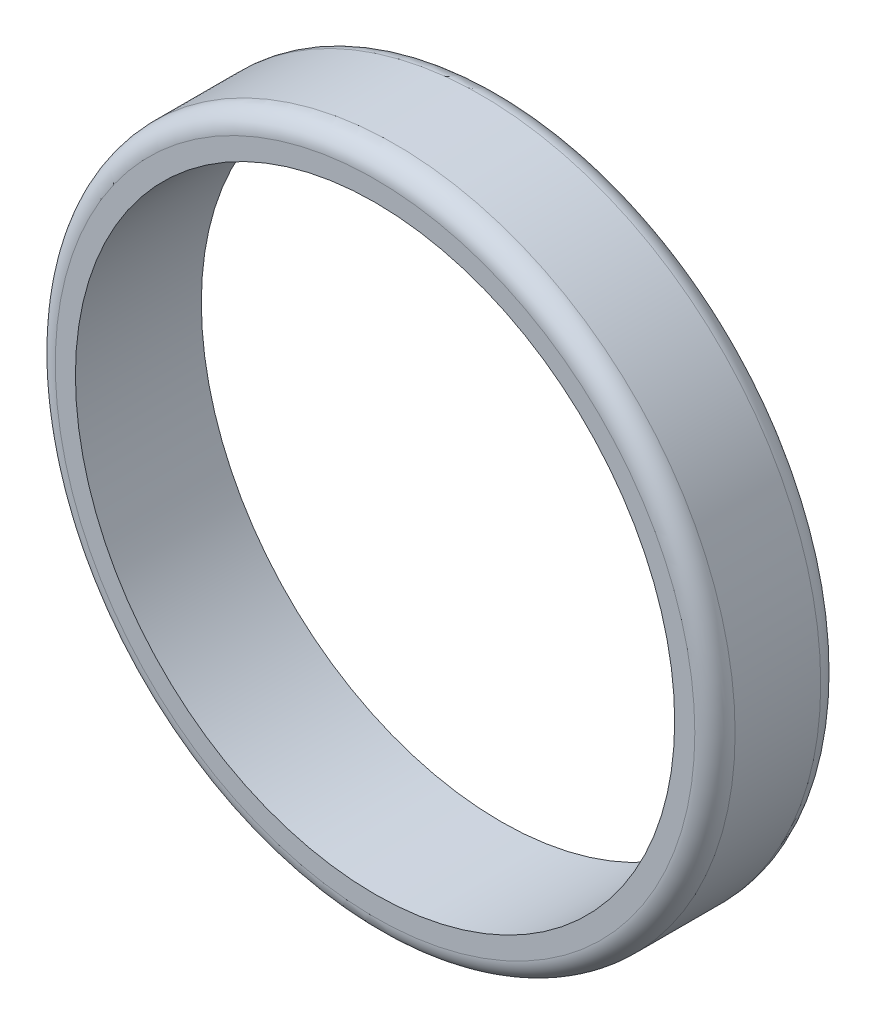
from build123d import *

# Parameters (mm, degrees)
SKETCH_1_R      = 67.5
SKETCH_1_R_2    = 59.5
EXTRUDE_1_DEPTH = 25
FILLET_1_R      = 4


with BuildPart() as part:
    # 草图1 → 凸台-拉伸1 (new body)
    with BuildSketch(Plane.XY):
        Circle(SKETCH_1_R)
        Circle(SKETCH_1_R_2, mode=Mode.SUBTRACT)
    extrude(amount=EXTRUDE_1_DEPTH)

    # 圆角1
    fillet_1_edges = [part.edges().sort_by_distance(p)[0] for p in [
        (-67.5, 0, 0),
        (-67.5, 0, 25),
    ]]
    fillet(fillet_1_edges, radius=FILLET_1_R)


solid = part.part
